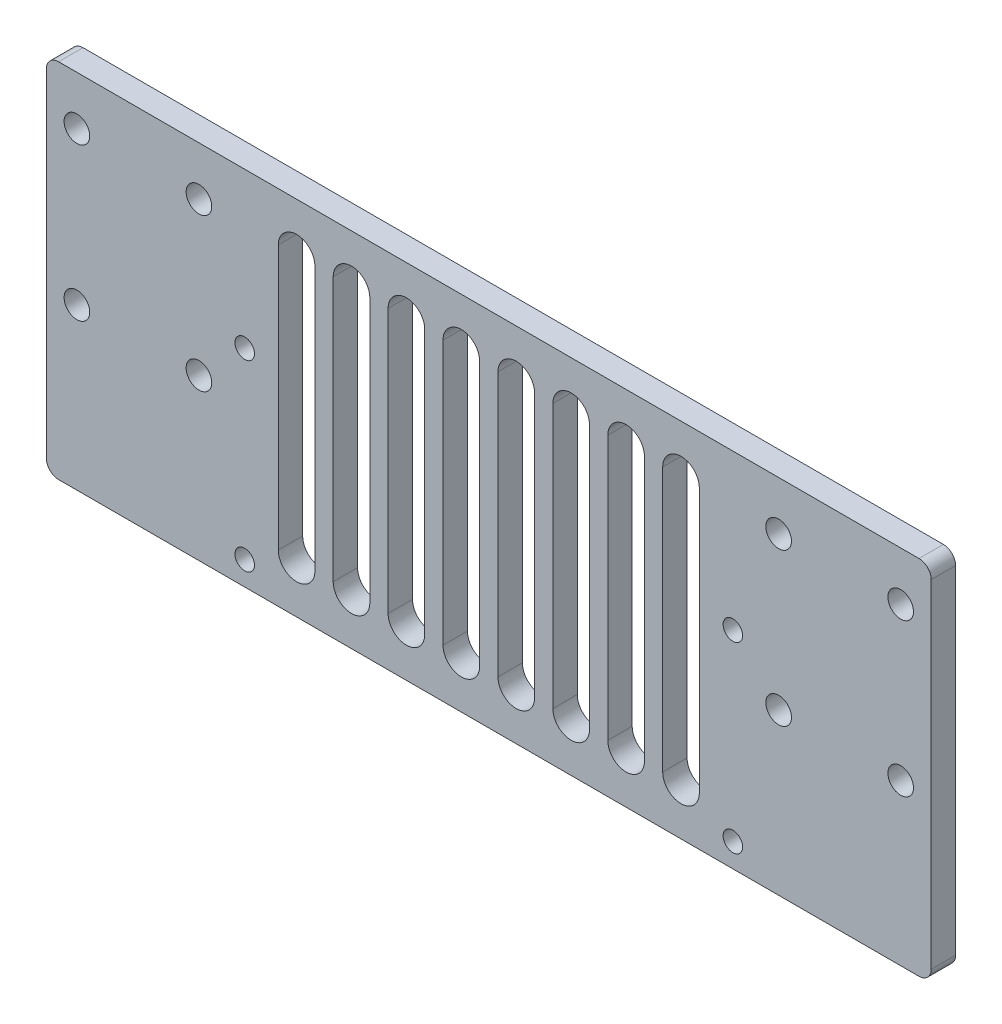
from build123d import *

# Parameters (mm, degrees)
SKETCH_1_W          = 145
SKETCH_1_H          = 59.3
EXTRUDE_1_DEPTH     = 4
SKETCH_2_R          = 2.1
CUT_EXTRUDE_1_DEPTH = 4
SKETCH_3_R          = 1.6
CUT_EXTRUDE_2_DEPTH = 4
FILLET_1_R          = 2
CUT_EXTRUDE_3_DEPTH = 5


with BuildPart() as part:
    # 草图1 → 凸台-拉伸1 (new body)
    with BuildSketch(Plane.XY):
        Rectangle(SKETCH_1_W, SKETCH_1_H)
    extrude(amount=EXTRUDE_1_DEPTH)

    # 草图2 → 切除-拉伸1 (cut)
    with BuildSketch(Plane.XY.offset(4)):
        with Locations((-67.5, 21.65)):
            Circle(SKETCH_2_R)
        with Locations((67.5, 21.65)):
            Circle(SKETCH_2_R)
        with Locations((67.5, -3.35)):
            Circle(SKETCH_2_R)
        with Locations((-67.5, -3.35)):
            Circle(SKETCH_2_R)
        with Locations((-47.5, 21.65)):
            Circle(SKETCH_2_R)
        with Locations((47.5, 21.65)):
            Circle(SKETCH_2_R)
        with Locations((47.5, -3.35)):
            Circle(SKETCH_2_R)
        with Locations((-47.5, -3.35)):
            Circle(SKETCH_2_R)
    extrude(amount=-CUT_EXTRUDE_1_DEPTH, mode=Mode.SUBTRACT)

    # 草图3 → 切除-拉伸2 (cut)
    with BuildSketch(Plane.XY.offset(4)):
        with Locations((-40, 4.25)):
            Circle(SKETCH_3_R)
        with Locations((40, 4.25)):
            Circle(SKETCH_3_R)
        with Locations((40, -25.75)):
            Circle(SKETCH_3_R)
        with Locations((-40, -25.75)):
            Circle(SKETCH_3_R)
    extrude(amount=-CUT_EXTRUDE_2_DEPTH, mode=Mode.SUBTRACT)

    # 圆角1
    fillet_1_edges = [part.edges().sort_by_distance(p)[0] for p in [
        (72.5, -29.65, 2),
        (-72.5, -29.65, 2),
        (-72.5, 29.65, 2),
        (72.5, 29.65, 2),
    ]]
    fillet(fillet_1_edges, radius=FILLET_1_R)

    # 草图4 → 切除-拉伸3 (cut)
    with BuildSketch(Plane.XY.offset(4)):
        with BuildLine():
            Line((-28.5, 21.65), (-28.5, -21.65))
            ThreePointArc((-28.5, -21.65), (-31.5, -24.65), (-34.5, -21.65))
            Line((-34.5, -21.65), (-34.5, 21.65))
            ThreePointArc((-34.5, 21.65), (-31.5, 24.65), (-28.5, 21.65))
        make_face()
        with BuildLine():
            Line((-19.5, 21.65), (-19.5, -21.65))
            ThreePointArc((-19.5, -21.65), (-22.5, -24.65), (-25.5, -21.65))
            Line((-25.5, -21.65), (-25.5, 21.65))
            ThreePointArc((-25.5, 21.65), (-22.5, 24.65), (-19.5, 21.65))
        make_face()
        with BuildLine():
            Line((-10.5, 21.65), (-10.5, -21.65))
            ThreePointArc((-10.5, -21.65), (-13.5, -24.65), (-16.5, -21.65))
            Line((-16.5, -21.65), (-16.5, 21.65))
            ThreePointArc((-16.5, 21.65), (-13.5, 24.65), (-10.5, 21.65))
        make_face()
        with BuildLine():
            Line((-1.5, 21.65), (-1.5, -21.65))
            ThreePointArc((-1.5, -21.65), (-4.5, -24.65), (-7.5, -21.65))
            Line((-7.5, -21.65), (-7.5, 21.65))
            ThreePointArc((-7.5, 21.65), (-4.5, 24.65), (-1.5, 21.65))
        make_face()
        with BuildLine():
            Line((7.5, 21.65), (7.5, -21.65))
            ThreePointArc((7.5, -21.65), (4.5, -24.65), (1.5, -21.65))
            Line((1.5, -21.65), (1.5, 21.65))
            ThreePointArc((1.5, 21.65), (4.5, 24.65), (7.5, 21.65))
        make_face()
        with BuildLine():
            Line((16.5, 21.65), (16.5, -21.65))
            ThreePointArc((16.5, -21.65), (13.5, -24.65), (10.5, -21.65))
            Line((10.5, -21.65), (10.5, 21.65))
            ThreePointArc((10.5, 21.65), (13.5, 24.65), (16.5, 21.65))
        make_face()
        with BuildLine():
            Line((25.5, 21.65), (25.5, -21.65))
            ThreePointArc((25.5, -21.65), (22.5, -24.65), (19.5, -21.65))
            Line((19.5, -21.65), (19.5, 21.65))
            ThreePointArc((19.5, 21.65), (22.5, 24.65), (25.5, 21.65))
        make_face()
        with BuildLine():
            Line((34.5, 21.65), (34.5, -21.65))
            ThreePointArc((34.5, -21.65), (31.5, -24.65), (28.5, -21.65))
            Line((28.5, -21.65), (28.5, 21.65))
            ThreePointArc((28.5, 21.65), (31.5, 24.65), (34.5, 21.65))
        make_face()
    extrude(amount=-CUT_EXTRUDE_3_DEPTH, mode=Mode.SUBTRACT)


solid = part.part
